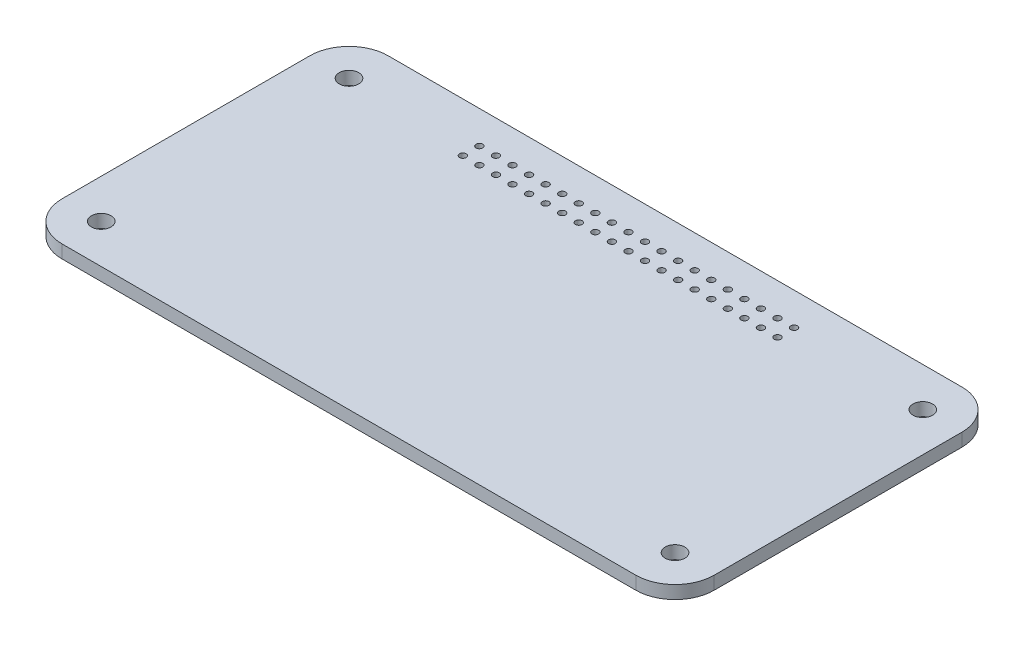
from build123d import *

# Parameters (mm, degrees)
SKETCH1_W             = 100
SKETCH1_H             = 50
BOSS_EXTRUDE1_DEPTH   = 2
FILLET1_R             = 6
F_3_0MM_DOWEL_HOLE1_D = 3
F_1_0MM_DOWEL_HOLE1_D = 1.02
LPATTERN1_COUNT       = 2
LPATTERN1_PITCH       = 2.54
LPATTERN1_COUNT_DIR2  = 20
LPATTERN1_PITCH_DIR2  = 2.54


with BuildPart() as part:
    # Sketch1 → Boss-Extrude1 (new body)
    with BuildSketch(Plane(origin=(0, 0, 0), x_dir=(1, 0, 0), z_dir=(0, 1, 0))):
        Rectangle(SKETCH1_W, SKETCH1_H)
    extrude(amount=BOSS_EXTRUDE1_DEPTH)

    # Fillet1
    fillet1_edges = [part.edges().sort_by_distance(p)[0] for p in [
        (50, 1, 25),
        (-50, 1, 25),
        (-50, 1, -25),
        (50, 1, -25),
    ]]
    fillet(fillet1_edges, radius=FILLET1_R)

    # Ø3.0mm Dowel Hole1 (through all)
    with Locations(Plane(origin=(-44, 2, -19), x_dir=(0, 0, 1), z_dir=(0, 1, 0))):
        with Locations((0, 0), (0, 88), (38, 88), (38, 0)):
            Hole(F_3_0MM_DOWEL_HOLE1_D / 2)

    # Ø1.0mm Dowel Hole1 (through all)
    with Locations(Plane(origin=(-25, 2, -20), x_dir=(0, 0, 1), z_dir=(0, 1, 0))):
        with Locations((0, 0)):
            f_1_0mm_dowel_hole1 = Hole(F_1_0MM_DOWEL_HOLE1_D / 2)

    # LPattern1: 1.0mm Dowel Hole1 2 × 20
    with Locations(*[(j * LPATTERN1_PITCH_DIR2, 0, i * LPATTERN1_PITCH) for i in range(LPATTERN1_COUNT) for j in range(LPATTERN1_COUNT_DIR2) if (i, j) != (0, 0)]):
        add(f_1_0mm_dowel_hole1, mode=Mode.SUBTRACT)


solid = part.part
